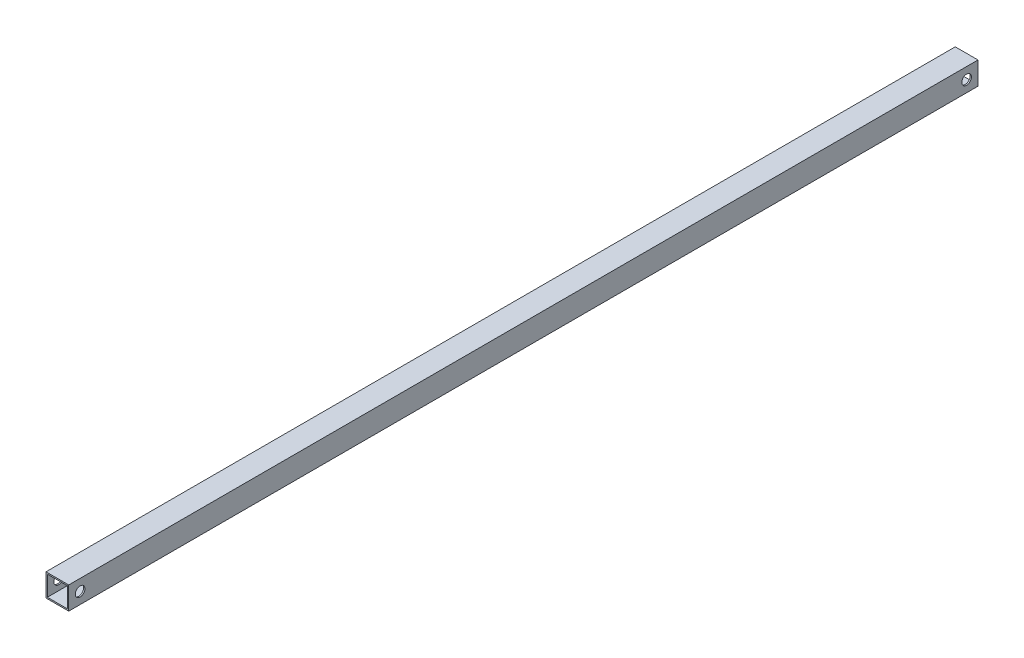
from build123d import *

# Parameters (mm, degrees)
SKETCH1_W           = 20
SKETCH1_H           = 20
SKETCH1_W_2         = 17.6
SKETCH1_H_2         = 17.6
BOSS_EXTRUDE1_DEPTH = 800
SKETCH2_R           = 4.25
CUT_EXTRUDE1_DEPTH  = 801.312438989


with BuildPart() as part:
    # Sketch1 → Boss-Extrude1 (new body)
    with BuildSketch(Plane.XY):
        Rectangle(SKETCH1_W, SKETCH1_H)
        Rectangle(SKETCH1_W_2, SKETCH1_H_2, mode=Mode.SUBTRACT)
    extrude(amount=BOSS_EXTRUDE1_DEPTH)

    # Sketch2 → Cut-Extrude1 (cut, through all)
    with BuildSketch(Plane(origin=(10, 0, 0), x_dir=(0, 0, -1), z_dir=(1, 0, 0))):
        with Locations((-10, 0)):
            Circle(SKETCH2_R)
        with Locations((-790, 0)):
            Circle(SKETCH2_R)
    extrude(amount=-CUT_EXTRUDE1_DEPTH, mode=Mode.SUBTRACT)


solid = part.part
